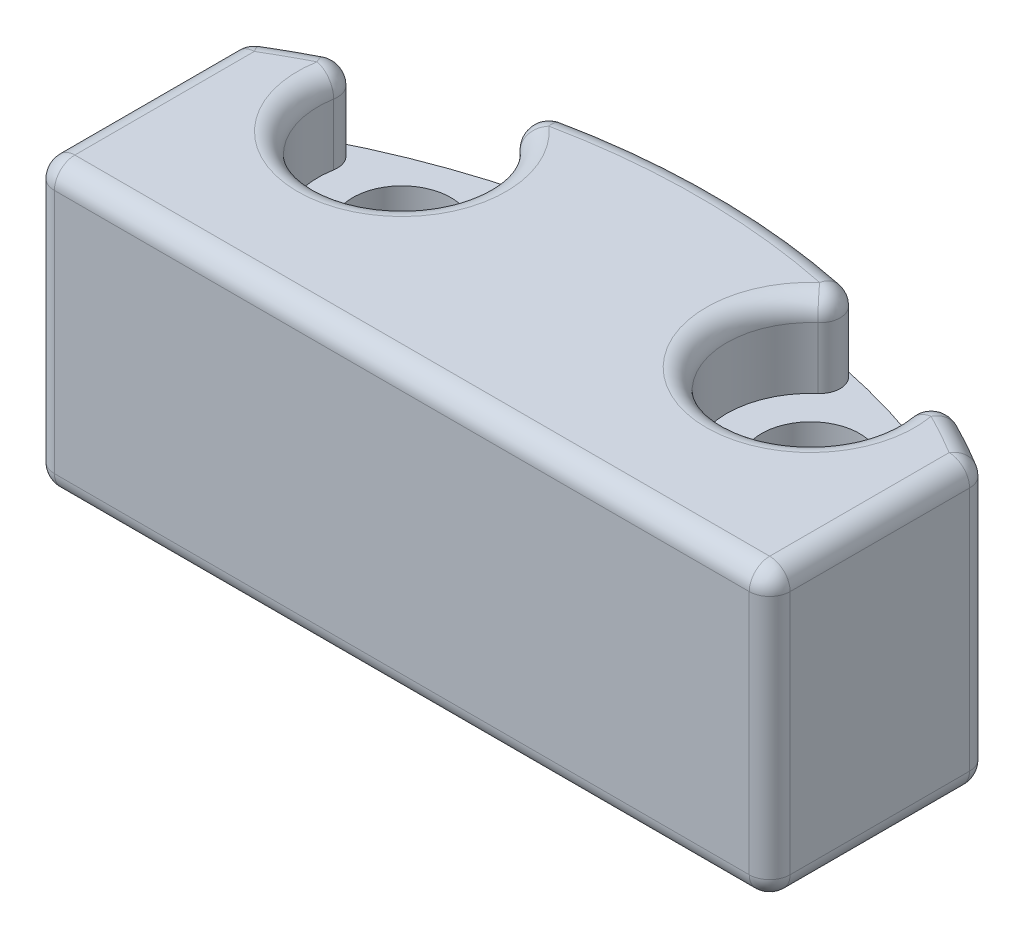
from build123d import *

# Parameters (mm, degrees)
SKETCH1_R           = 1.2
BOSS_EXTRUDE1_DEPTH = 7
SKETCH2_R           = 2.05
CUT_EXTRUDE1_DEPTH  = 2
FILLET1_R           = 0.5


with BuildPart() as part:
    # Sketch1 → Boss-Extrude1 (new body)
    with BuildSketch(Plane(origin=(0, 0, 0), x_dir=(1, 0, 0), z_dir=(0, 1, 0))):
        with BuildLine():
            Line((0, 0), (0, -5.17))
            Line((0, -5.17), (18, -5.17))
            Line((18, -5.17), (18, 0))
            ThreePointArc((18, 0), (9, 2.577794898), (0, 0))
        make_face()
        with Locations(Location((4, -0.17, 0), (0, 0, 270))):
            Circle(SKETCH1_R, mode=Mode.SUBTRACT)
        with Locations(Location((14, -0.17, 0), (0, 0, 270))):
            Circle(SKETCH1_R, mode=Mode.SUBTRACT)
    extrude(amount=BOSS_EXTRUDE1_DEPTH)

    # Sketch2 → Cut-Extrude1 (cut)
    with BuildSketch(Plane(origin=(0, 7, 0), x_dir=(1, 0, 0), z_dir=(0, 1, 0))):
        with Locations((4, -0.17)):
            Circle(SKETCH2_R)
        with Locations((14, -0.17)):
            Circle(SKETCH2_R)
    extrude(amount=-CUT_EXTRUDE1_DEPTH, mode=Mode.SUBTRACT)

    # Fillet1
    fillet1_edges = [part.edges().sort_by_distance(p)[0] for p in [
        (0, 7, 2.585),
        (9, 7, 5.17),
        (9, 7, -2.577794898),
        (1.271083669, 7, -0.719256266),
        (13.841338508, 6, -1.873850907),
        (15.400788894, 6, -1.326759992),
        (2.599211106, 6, -1.326759992),
        (4.158661492, 6, -1.873850907),
        (4.678636308, 7, 2.104412769),
        (13.321363692, 7, 2.104412769),
        (18, 7, 2.585),
        (9, 0, 5.17),
        (0, 0, 2.585),
        (9, 0, -2.577794898),
        (18, 0, 2.585),
        (18, 3.5, 5.17),
        (0, 3.5, 5.17),
        (0, 3.5, 0),
        (18, 3.5, 0),
        (16.728916331, 7, -0.719256266),
    ]]
    fillet(fillet1_edges, radius=FILLET1_R)


solid = part.part
